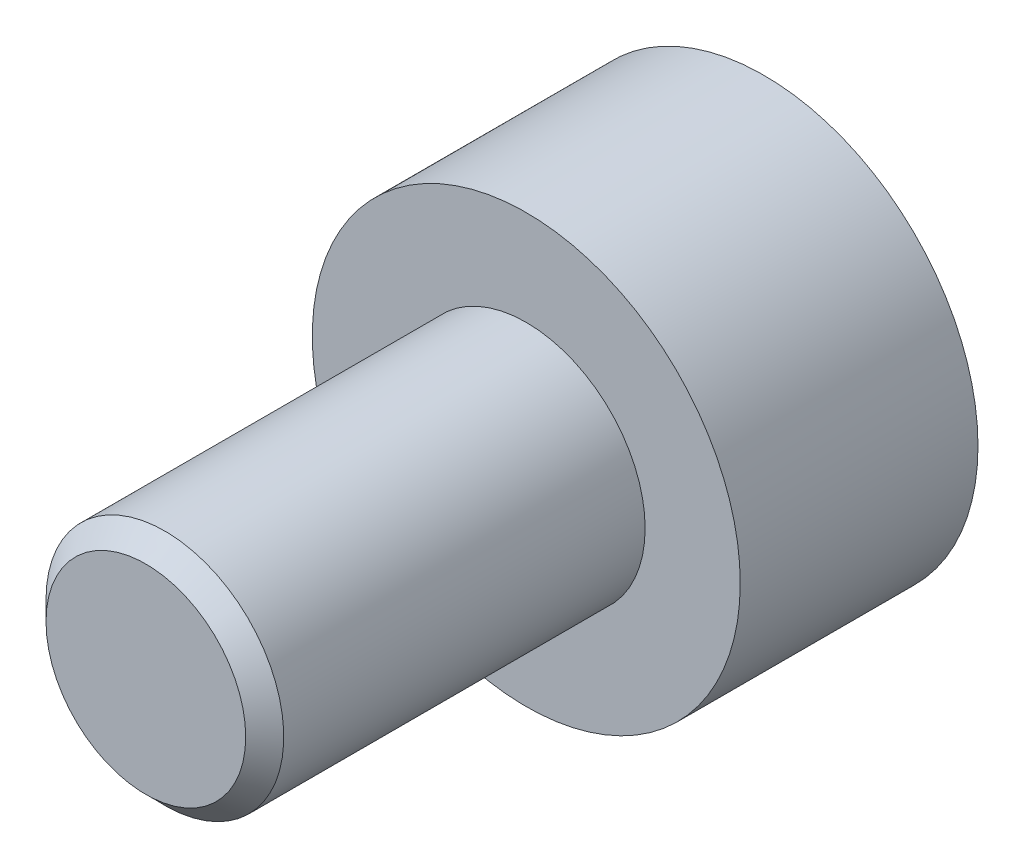
from build123d import *

# Parameters (mm, degrees)
SKETCH_1_R          = 2.25
EXTRUDE_1_DEPTH     = 2.5
SKETCH_2_R          = 1.25
EXTRUDE_2_DEPTH     = 4
CHAMFER_1_SIZE      = 0.2
CUT_EXTRUDE_1_DEPTH = 1.1


with BuildPart() as part:
    # 草图1 → 凸台-拉伸1 (new body)
    with BuildSketch(Plane.XY):
        Circle(SKETCH_1_R)
    extrude(amount=EXTRUDE_1_DEPTH)

    # 草图2 → 凸台-拉伸2 (add)
    with BuildSketch(Plane.XY.offset(2.5)):
        Circle(SKETCH_2_R)
    extrude(amount=EXTRUDE_2_DEPTH)

    # 倒角1
    chamfer_1_edges = [part.edges().sort_by_distance(p)[0] for p in [
        (-1.25, 0, 6.5),
    ]]
    chamfer(chamfer_1_edges, length=CHAMFER_1_SIZE)

    # 草图3 → 切除-拉伸1 (cut)
    with BuildSketch(Plane(origin=(0, 0, 0), x_dir=(-1, 0, 0), z_dir=(0, 0, -1))):
        Polygon((0, 1.177794549), (-1.02, 0.588897275), (-1.02, -0.588897275), (0, -1.177794549), (1.02, -0.588897275), (1.02, 0.588897275), align=None)
    extrude(amount=-CUT_EXTRUDE_1_DEPTH, mode=Mode.SUBTRACT)


solid = part.part
